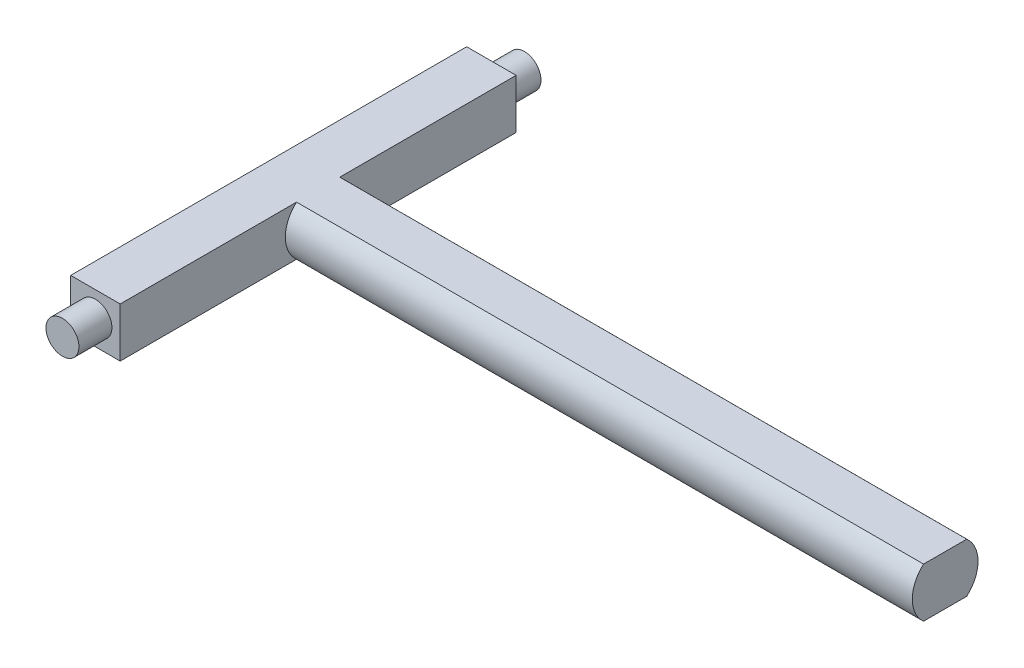
from build123d import *

# Parameters (mm, degrees)
SKETCH1_W           = 304.8
SKETCH1_H           = 38.1
BOSS_EXTRUDE5_DEPTH = 38.1
BOSS_EXTRUDE6_DEPTH = 25.4
BOSS_EXTRUDE7_DEPTH = 25.4
BOSS_EXTRUDE8_DEPTH = 482.6


with BuildPart() as part:
    # Sketch1 → Boss-Extrude5 (new body)
    with BuildSketch(Plane(origin=(0, 0, 0), x_dir=(0, 0, -1), z_dir=(1, 0, 0))):
        with Locations((0, 19.05)):
            Rectangle(SKETCH1_W, SKETCH1_H)
    extrude(amount=BOSS_EXTRUDE5_DEPTH)

    # Sketch7 → Boss-Extrude6 (add)
    with BuildSketch(Plane.XY.offset(152.4)):
        with BuildLine():
            ThreePointArc((28.011830747, 28.011830747), (19.05, 31.723942586), (10.088169253, 28.011830747))
            Line((10.088169253, 28.011830747), (19.05, 19.05))
            Line((19.05, 19.05), (28.011830747, 28.011830747))
        make_face()
        with BuildLine():
            Line((19.05, 19.05), (10.088169253, 28.011830747))
            ThreePointArc((10.088169253, 28.011830747), (6.376057414, 19.05), (10.088169253, 10.088169253))
            Line((10.088169253, 10.088169253), (19.05, 19.05))
        make_face()
        with BuildLine():
            Line((28.011830747, 28.011830747), (19.05, 19.05))
            Line((19.05, 19.05), (28.011830747, 10.088169253))
            ThreePointArc((28.011830747, 10.088169253), (30.759196151, 14.19989215), (31.723942586, 19.05))
            ThreePointArc((31.723942586, 19.05), (30.759196151, 23.90010785), (28.011830747, 28.011830747))
        make_face()
        with BuildLine():
            Line((28.011830747, 10.088169253), (19.05, 19.05))
            Line((19.05, 19.05), (10.088169253, 10.088169253))
            ThreePointArc((10.088169253, 10.088169253), (19.05, 6.376057414), (28.011830747, 10.088169253))
        make_face()
    extrude(amount=BOSS_EXTRUDE6_DEPTH)

    # Sketch8 → Boss-Extrude7 (add)
    with BuildSketch(Plane(origin=(0, 0, -152.4), x_dir=(-1, 0, 0), z_dir=(0, 0, -1))):
        with BuildLine():
            ThreePointArc((-10.044344025, 28.055655975), (-19.05, 31.785920818), (-28.055655975, 28.055655975))
            Line((-28.055655975, 28.055655975), (-19.05, 19.05))
            Line((-19.05, 19.05), (-10.044344025, 28.055655975))
        make_face()
        with BuildLine():
            Line((-19.05, 19.05), (-28.055655975, 28.055655975))
            ThreePointArc((-28.055655975, 28.055655975), (-31.785920818, 19.05), (-28.055655975, 10.044344025))
            Line((-28.055655975, 10.044344025), (-19.05, 19.05))
        make_face()
        with BuildLine():
            Line((-10.044344025, 28.055655975), (-19.05, 19.05))
            Line((-19.05, 19.05), (-10.044344025, 10.044344025))
            ThreePointArc((-10.044344025, 10.044344025), (-7.283543428, 14.176174107), (-6.314079182, 19.05))
            ThreePointArc((-6.314079182, 19.05), (-7.283543428, 23.923825893), (-10.044344025, 28.055655975))
        make_face()
        with BuildLine():
            Line((-10.044344025, 10.044344025), (-19.05, 19.05))
            Line((-19.05, 19.05), (-28.055655975, 10.044344025))
            ThreePointArc((-28.055655975, 10.044344025), (-19.05, 6.314079182), (-10.044344025, 10.044344025))
        make_face()
    extrude(amount=BOSS_EXTRUDE7_DEPTH)

    # Sketch9 → Boss-Extrude8 (add)
    with BuildSketch(Plane(origin=(38.1, 0, 0), x_dir=(0, 0, -1), z_dir=(1, 0, 0))):
        with BuildLine():
            Line((-16.624944564, 0), (0, 0))
            Line((0, 0), (0, 38.1))
            Line((0, 38.1), (-16.624944564, 38.1))
            ThreePointArc((-16.624944564, 38.1), (-25.284210127, 19.05), (-16.624944564, 0))
        make_face()
        with BuildLine():
            Line((0, 38.1), (0, 0))
            Line((0, 0), (16.624944564, 0))
            ThreePointArc((16.624944564, 0), (23.01781781, 8.587144509), (25.284210127, 19.05))
            ThreePointArc((25.284210127, 19.05), (23.01781781, 29.512855491), (16.624944564, 38.1))
            Line((16.624944564, 38.1), (0, 38.1))
        make_face()
    extrude(amount=BOSS_EXTRUDE8_DEPTH)


solid = part.part
